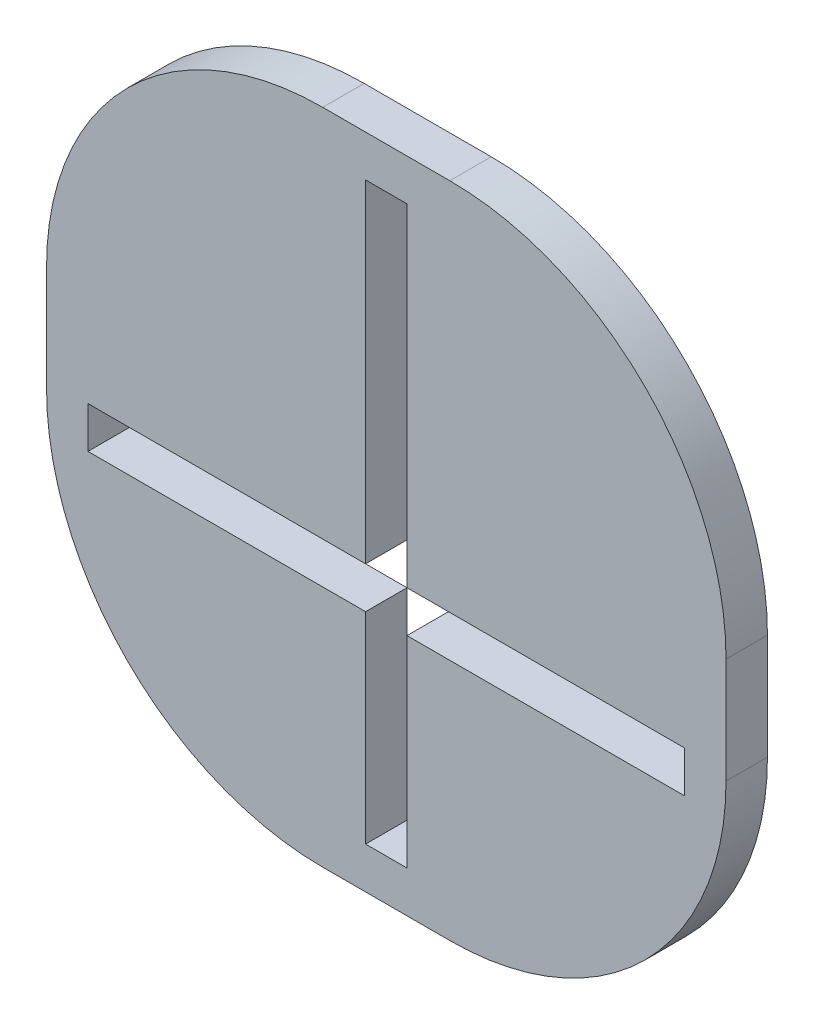
from build123d import *

# Parameters (mm, degrees)
SALIENTE_EXTRUIR1_DEPTH = 3


with BuildPart() as part:
    # Croquis1 → Saliente-Extruir1 (new body)
    with BuildSketch(Plane.XY):
        with BuildLine():
            Line((-4.6, -23.825), (4.6, -23.825))
            ThreePointArc((4.6, -23.825), (18.742135624, -17.967135624), (24.6, -3.825))
            Line((24.6, -3.825), (24.6, 3.825))
            ThreePointArc((24.6, 3.825), (18.742135624, 17.967135624), (4.6, 23.825))
            Line((4.6, 23.825), (-4.6, 23.825))
            ThreePointArc((-4.6, 23.825), (-18.742135624, 17.967135624), (-24.6, 3.825))
            Line((-24.6, 3.825), (-24.6, -3.825))
            ThreePointArc((-24.6, -3.825), (-18.742135624, -17.967135624), (-4.6, -23.825))
        make_face()
        Polygon((-21.6, -6.25), (-21.6, -3.25), (-1.5, -3.25), (-1.5, 20.825), (1.5, 20.825), (1.5, -3.25), (21.6, -3.25), (21.6, -6.25), (1.5, -6.25), (1.5, -20.825), (-1.5, -20.825), (-1.5, -6.25), align=None, mode=Mode.SUBTRACT)
    extrude(amount=SALIENTE_EXTRUIR1_DEPTH)


solid = part.part
